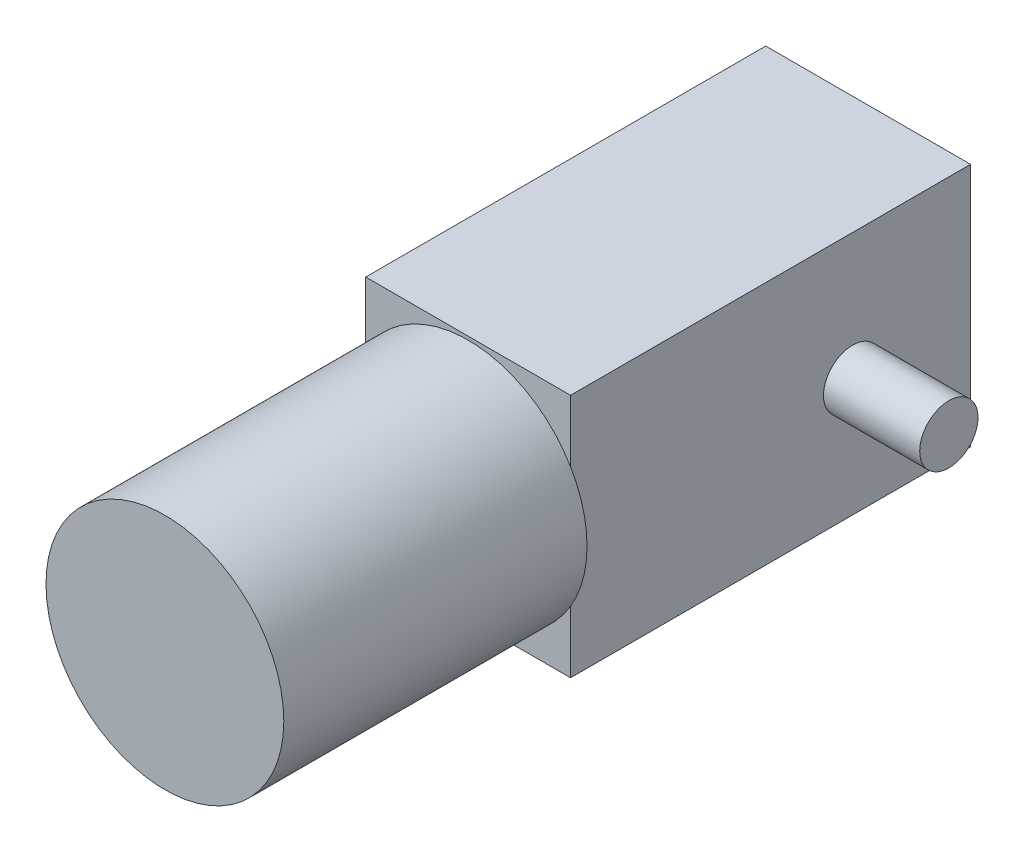
from build123d import *

# Parameters (mm, degrees)
SKETCH1_W           = 18.923
SKETCH1_H           = 22.606
BOSS_EXTRUDE1_DEPTH = 36.957
SKETCH2_R           = 10.9855
BOSS_EXTRUDE2_DEPTH = 28.0162
SKETCH3_W           = 2.794
SKETCH3_H           = 5.08
BOSS_EXTRUDE3_DEPTH = 5.08
SKETCH4_R           = 2.6924
BOSS_EXTRUDE4_DEPTH = 8.89


with BuildPart() as part:
    # Sketch1 → Boss-Extrude1 (new body)
    with BuildSketch(Plane.XY):
        with Locations((9.4615, 11.303)):
            Rectangle(SKETCH1_W, SKETCH1_H)
    extrude(amount=BOSS_EXTRUDE1_DEPTH)

    # Sketch2 → Boss-Extrude2 (add)
    with BuildSketch(Plane.XY.offset(36.957)):
        with Locations(Location((9.4615, 11.303, 0), (0, 0, 149.45966787))):
            Circle(SKETCH2_R)
    extrude(amount=BOSS_EXTRUDE2_DEPTH)

    # Sketch3 → Boss-Extrude3 (add)
    with BuildSketch(Plane(origin=(0, 0, 0), x_dir=(-1, 0, 0), z_dir=(0, 0, -1))):
        with Locations((-9.4615, 11.303)):
            Rectangle(SKETCH3_W, SKETCH3_H)
    extrude(amount=BOSS_EXTRUDE3_DEPTH)

    # Sketch4 → Boss-Extrude4 (add)
    with BuildSketch(Plane(origin=(18.923, 0, 0), x_dir=(0, 0, -1), z_dir=(1, 0, 0))):
        with Locations(Location((-10.8966, 10.8966, 0), (0, 0, 180))):
            Circle(SKETCH4_R)
    boss_extrude4 = extrude(amount=BOSS_EXTRUDE4_DEPTH)

    # Mirror1: Boss-Extrude4 across plane
    add(boss_extrude4.mirror(Plane(origin=(9.4615, 0, 0), x_dir=(0, 0, 1), z_dir=(1, 0, 0))))


solid = part.part
